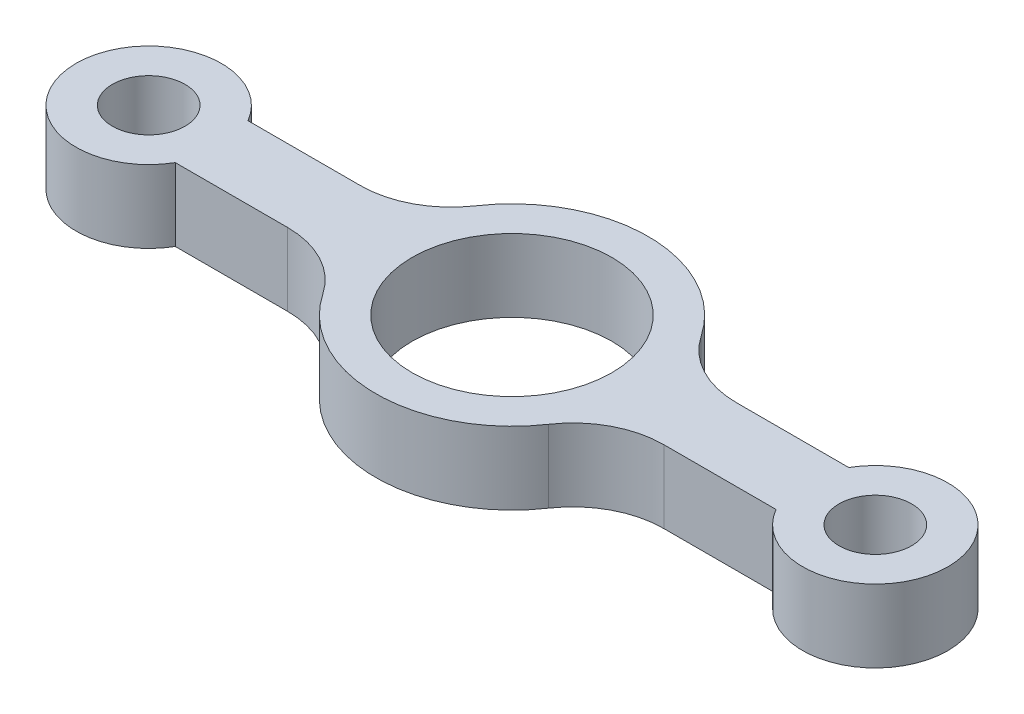
from build123d import *

# Parameters (mm, degrees)
ESBO_O1_R                = 4
ESBO_O1_R_2              = 11
RESSALTO_EXTRUS_O1_DEPTH = 8


with BuildPart() as part:
    # Esboço1 → Ressalto-extrusão1 (new body)
    with BuildSketch(Plane(origin=(0, 0, 0), x_dir=(1, 0, 0), z_dir=(0, 1, 0))):
        with BuildLine():
            Line((-33.07179677, 4), (-20.712315177, 4))
            ThreePointArc((-20.712315177, 4), (-16.021899417, 5.168239134), (-12.427389106, 8.4))
            ThreePointArc((-12.427389106, 8.4), (0, 15), (12.427389106, 8.4))
            ThreePointArc((12.427389106, 8.4), (16.021899417, 5.168239134), (20.712315177, 4))
            Line((20.712315177, 4), (33.07179677, 4))
            ThreePointArc((33.07179677, 4), (48, 0), (33.07179677, -4))
            Line((33.07179677, -4), (20.712315177, -4))
            ThreePointArc((20.712315177, -4), (16.021899417, -5.168239134), (12.427389106, -8.4))
            ThreePointArc((12.427389106, -8.4), (0, -15), (-12.427389106, -8.4))
            ThreePointArc((-12.427389106, -8.4), (-16.021899417, -5.168239134), (-20.712315177, -4))
            Line((-20.712315177, -4), (-33.07179677, -4))
            ThreePointArc((-33.07179677, -4), (-48, 0), (-33.07179677, 4))
        make_face()
        with Locations(Location((40, 0, 0), (0, 0, 270))):
            Circle(ESBO_O1_R, mode=Mode.SUBTRACT)
        with Locations(Location((-40, 0, 0), (0, 0, 270))):
            Circle(ESBO_O1_R, mode=Mode.SUBTRACT)
        with Locations(Location((0, 0, 0), (0, 0, 270))):
            Circle(ESBO_O1_R_2, mode=Mode.SUBTRACT)
    extrude(amount=RESSALTO_EXTRUS_O1_DEPTH)


solid = part.part
